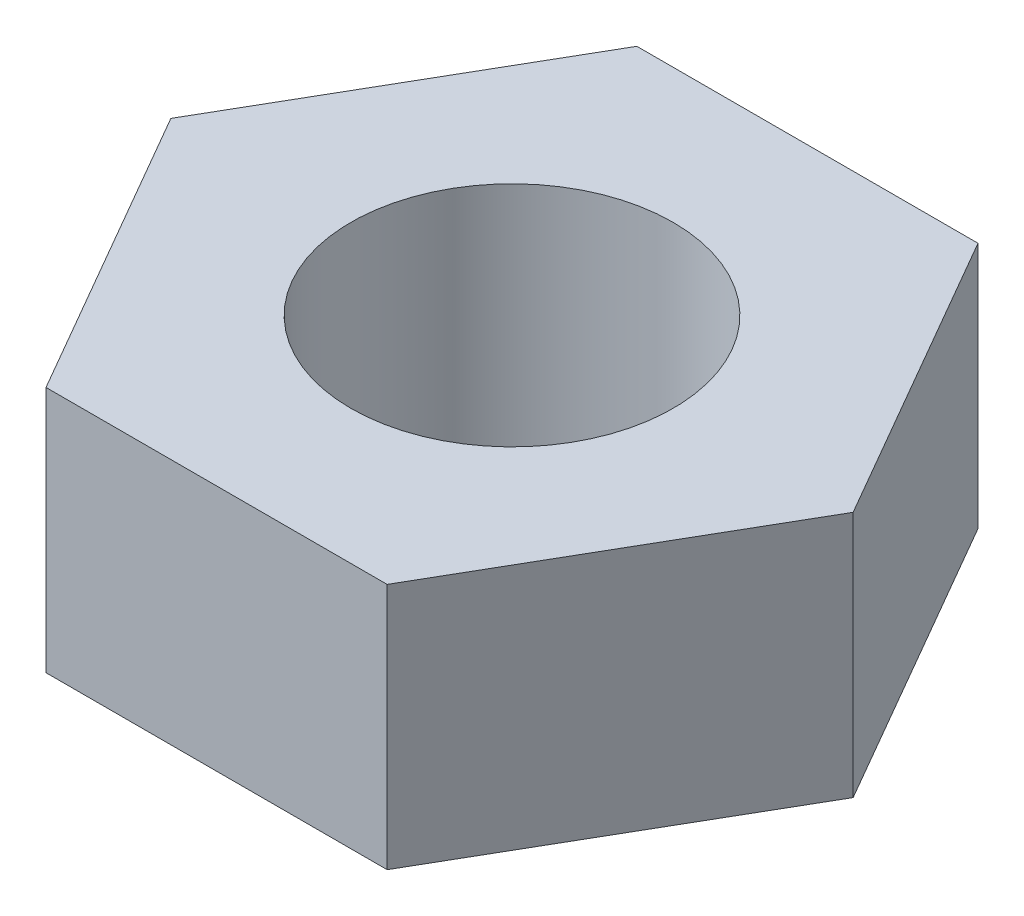
from build123d import *

# Parameters (mm, degrees)
SKETCH_1_R      = 1.5
EXTRUDE_1_DEPTH = 2.3


with BuildPart() as part:
    # 草图1 → 凸台-拉伸1 (new body)
    with BuildSketch(Plane(origin=(0, 0, 0), x_dir=(1, 0, 0), z_dir=(0, 1, 0))):
        Polygon((3.175426481, 0), (1.58771324, 2.75), (-1.58771324, 2.75), (-3.175426481, 0), (-1.58771324, -2.75), (1.58771324, -2.75), align=None)
        with Locations(Location((0, 0, 0), (0, 0, 270))):
            Circle(SKETCH_1_R, mode=Mode.SUBTRACT)
    extrude(amount=EXTRUDE_1_DEPTH)


solid = part.part
